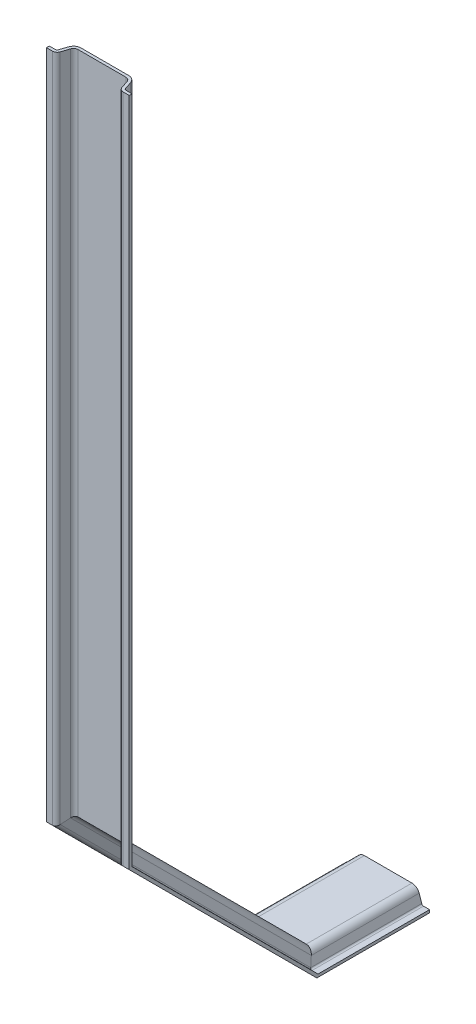
from build123d import *


with BuildPart() as part:
    # 扫描1: sweep along a path in 草图1
    with BuildLine(Plane(origin=(0, 0, 0), x_dir=(0, 0, -1), z_dir=(1, 0, 0))) as sweep_1_path:
        Line((-211.869954442, 132.702101833), (-211.869954442, -150.705045558))
        Line((-211.869954442, -150.705045558), (-132.575, -230))
        Line((-132.575, -230), (-84.915, -230))
    # 草图2 → 扫描1 (sweep)
    with BuildSketch(Plane(origin=(0, 132.702101833, 211.869954442), x_dir=(1, 0, 0), z_dir=(0, 1, 0))):
        with BuildLine():
            Line((17.5, 0), (14.94151844, 0))
            ThreePointArc((14.94151844, 0), (13.772097871, 0.37751563), (13.044151844, 1.367544468))
            Line((13.044151844, 1.367544468), (11.955848156, 4.632455532))
            ThreePointArc((11.955848156, 4.632455532), (11.227902129, 5.62248437), (10.05848156, 6))
            Line((10.05848156, 6), (-10.05848156, 6))
            ThreePointArc((-10.05848156, 6), (-11.227902129, 5.62248437), (-11.955848156, 4.632455532))
            Line((-11.955848156, 4.632455532), (-13.044151844, 1.367544468))
            ThreePointArc((-13.044151844, 1.367544468), (-13.772097871, 0.37751563), (-14.94151844, 0))
            Line((-14.94151844, 0), (-17.5, 0))
            Line((-17.5, 0), (-17.5, 1.2))
            Line((-17.5, 1.2), (-14.94151844, 1.2))
            ThreePointArc((-14.94151844, 1.2), (-14.473750212, 1.351006252), (-14.182571802, 1.747017787))
            Line((-14.182571802, 1.747017787), (-13.094268114, 5.011928851))
            ThreePointArc((-13.094268114, 5.011928851), (-11.929554471, 6.595974993), (-10.05848156, 7.2))
            Line((-10.05848156, 7.2), (10.05848156, 7.2))
            ThreePointArc((10.05848156, 7.2), (11.929554471, 6.595974993), (13.094268114, 5.011928851))
            Line((13.094268114, 5.011928851), (14.182571802, 1.747017787))
            ThreePointArc((14.182571802, 1.747017787), (14.473750212, 1.351006252), (14.94151844, 1.2))
            Line((14.94151844, 1.2), (17.5, 1.2))
            Line((17.5, 1.2), (17.5, 0))
        make_face()
    sweep(path=sweep_1_path.line, transition=Transition.RIGHT)


solid = part.part
